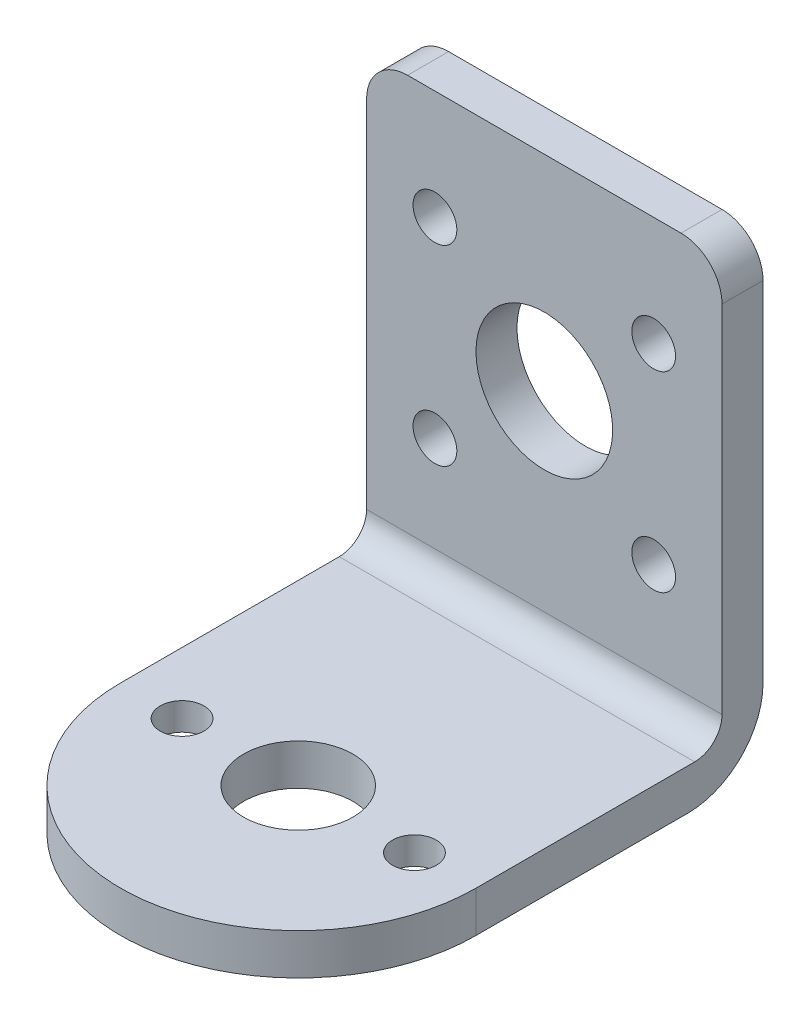
from build123d import *
from OCP.BRepFilletAPI import BRepFilletAPI_MakeChamfer

# Parameters (mm, degrees)
EXTRUDE_1_DEPTH     = 3
SKETCH_2_R          = 4
SKETCH_2_R_2        = 1.6
CUT_EXTRUDE_1_DEPTH = 5
SKETCH_3_W          = 26
SKETCH_3_H          = 3
EXTRUDE_2_DEPTH     = 31
FILLET_1_R          = 2
FILLET_2_R          = 5.5
SKETCH_4_R          = 5
SKETCH_4_R_2        = 1.6
CUT_EXTRUDE_2_DEPTH = 31
FILLET_3_R          = 3
CHAMFER_1_SIZE      = 1
CHAMFER_1_SIZE2     = 1.732050808


with BuildPart() as part:
    # ｽｹｯﾁ1 → ﾎﾞｽ - 押し出し1 (new body)
    with BuildSketch(Plane(origin=(0, 0, 0), x_dir=(1, 0, 0), z_dir=(0, 1, 0))):
        with BuildLine():
            Line((-13, 21), (-13, 0))
            ThreePointArc((-13, 0), (0, -13), (13, 0))
            Line((13, 0), (13, 21))
            Line((13, 21), (-13, 21))
        make_face()
    extrude(amount=EXTRUDE_1_DEPTH)

    # ｽｹｯﾁ2 → ｶｯﾄ - 押し出し1 (cut)
    with BuildSketch(Plane(origin=(0, 3, 0), x_dir=(1, 0, 0), z_dir=(0, 1, 0))):
        Circle(SKETCH_2_R)
        with Locations((-8.5, 0)):
            Circle(SKETCH_2_R_2)
        with Locations((8.5, 0)):
            Circle(SKETCH_2_R_2)
    extrude(amount=-CUT_EXTRUDE_1_DEPTH, mode=Mode.SUBTRACT)

    # ｽｹｯﾁ3 → ﾎﾞｽ - 押し出し2 (add)
    with BuildSketch(Plane(origin=(0, 3, 0), x_dir=(1, 0, 0), z_dir=(0, 1, 0))):
        with Locations((0, 19.5)):
            Rectangle(SKETCH_3_W, SKETCH_3_H)
    extrude(amount=EXTRUDE_2_DEPTH)

    # ﾌｨﾚｯﾄ1
    fillet_1_edges = [part.edges().sort_by_distance(p)[0] for p in [
        (0, 3, -18),
    ]]
    fillet(fillet_1_edges, radius=FILLET_1_R)

    # ﾌｨﾚｯﾄ2
    fillet_2_edges = [part.edges().sort_by_distance(p)[0] for p in [
        (0, 0, -21),
    ]]
    fillet(fillet_2_edges, radius=FILLET_2_R)

    # ｽｹｯﾁ4 → ｶｯﾄ - 押し出し2 (cut)
    with BuildSketch(Plane(origin=(0, 0, -21), x_dir=(-1, 0, 0), z_dir=(0, 0, -1))):
        with Locations((0, 19)):
            Circle(SKETCH_4_R)
        with Locations((-8, 26)):
            Circle(SKETCH_4_R_2)
        with Locations((8, 26)):
            Circle(SKETCH_4_R_2)
        with Locations((-8, 12)):
            Circle(SKETCH_4_R_2)
        with Locations((8, 12)):
            Circle(SKETCH_4_R_2)
    extrude(amount=-CUT_EXTRUDE_2_DEPTH, mode=Mode.SUBTRACT)

    # ﾌｨﾚｯﾄ3
    fillet_3_edges = [part.edges().sort_by_distance(p)[0] for p in [
        (-13, 34, -19.5),
        (13, 34, -19.5),
    ]]
    fillet(fillet_3_edges, radius=FILLET_3_R)

    # 面取り1: one chamfer whose edges measure the first distance from different faces: ONE call of the kernel's chamfer builder (chamfer() names one face for all edges)
    chamfer_1_edges_1 = [part.edges().sort_by_distance(p)[0] for p in [
        (-10.1, 0, 0),
    ]]
    chamfer_1_side_1 = [part.faces().sort_by_distance(p)[0] for p in [
        (-10.1, 1.5, 0),
    ]]
    chamfer_1_edges_2 = [part.edges().sort_by_distance(p)[0] for p in [
        (6.9, 0, 0),
    ]]
    chamfer_1_side_2 = [part.faces().sort_by_distance(p)[0] for p in [
        (6.9, 1.5, 0),
    ]]
    chamfer_1 = BRepFilletAPI_MakeChamfer(part.part.solid().wrapped)
    for e in chamfer_1_edges_1:
        chamfer_1.Add(CHAMFER_1_SIZE, CHAMFER_1_SIZE2, e.wrapped, chamfer_1_side_1[0].wrapped)  # the first distance lies on this face
    for e in chamfer_1_edges_2:
        chamfer_1.Add(CHAMFER_1_SIZE, CHAMFER_1_SIZE2, e.wrapped, chamfer_1_side_2[0].wrapped)  # the first distance lies on this face
    add(Compound.cast(chamfer_1.Shape()), mode=Mode.REPLACE)


solid = part.part
